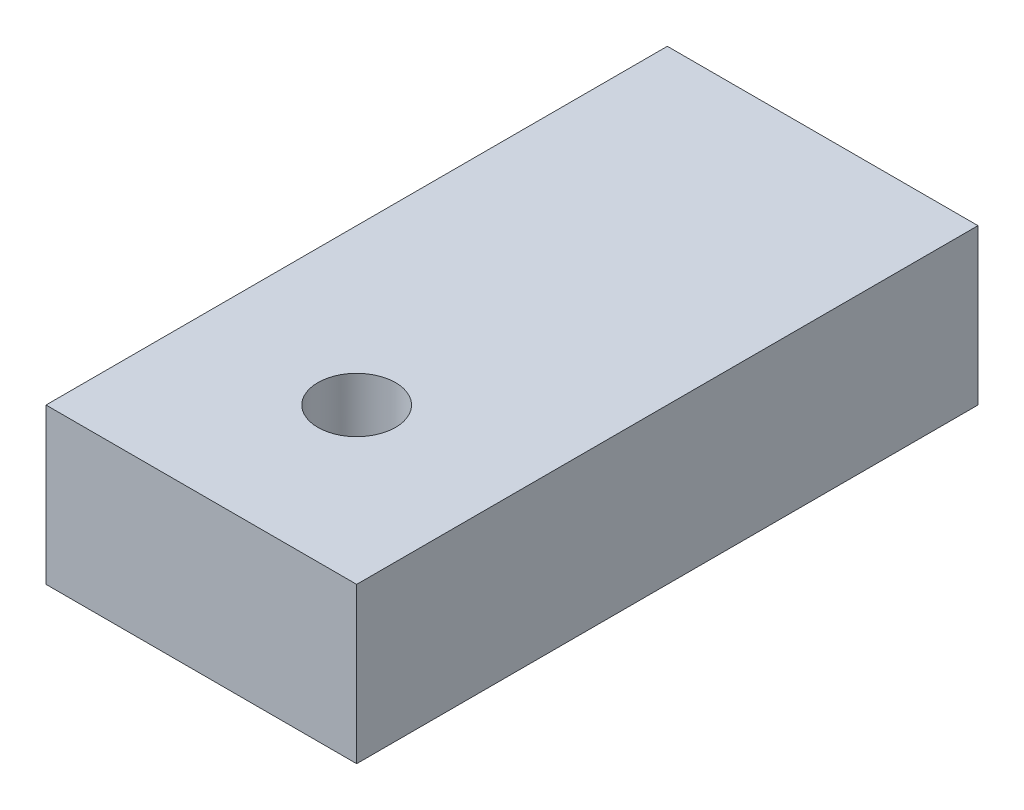
from build123d import *

# Parameters (mm, degrees)
SKETCH1_W               = 50.8
SKETCH1_H               = 25.4
BOSS_EXTRUDE1_DEPTH     = 101.6
CUT_EXTRUDE1_DEPTH      = 117.397422652
CUT_EXTRUDE1_DEPTH_BACK = 117.397422652
SKETCH2_R               = 6.35


with BuildPart() as part:
    # Sketch1 → Boss-Extrude1 (new body)
    with BuildSketch(Plane.XY):
        with Locations((25.4, 12.7)):
            Rectangle(SKETCH1_W, SKETCH1_H)
    extrude(amount=BOSS_EXTRUDE1_DEPTH)

    # Sketch2 → Cut-Extrude1 (cut, two sides: drawn at the far end of the back side and taken through both)
    with BuildSketch(Plane(origin=(0, 25.4, 0), x_dir=(1, 0, 0), z_dir=(0, 1, 0)).offset(-CUT_EXTRUDE1_DEPTH_BACK)):
        with Locations(Location((25.4, -76.2, 0), (0, 0, 270))):
            Circle(SKETCH2_R)
    extrude(amount=CUT_EXTRUDE1_DEPTH + CUT_EXTRUDE1_DEPTH_BACK, mode=Mode.SUBTRACT)


solid = part.part
